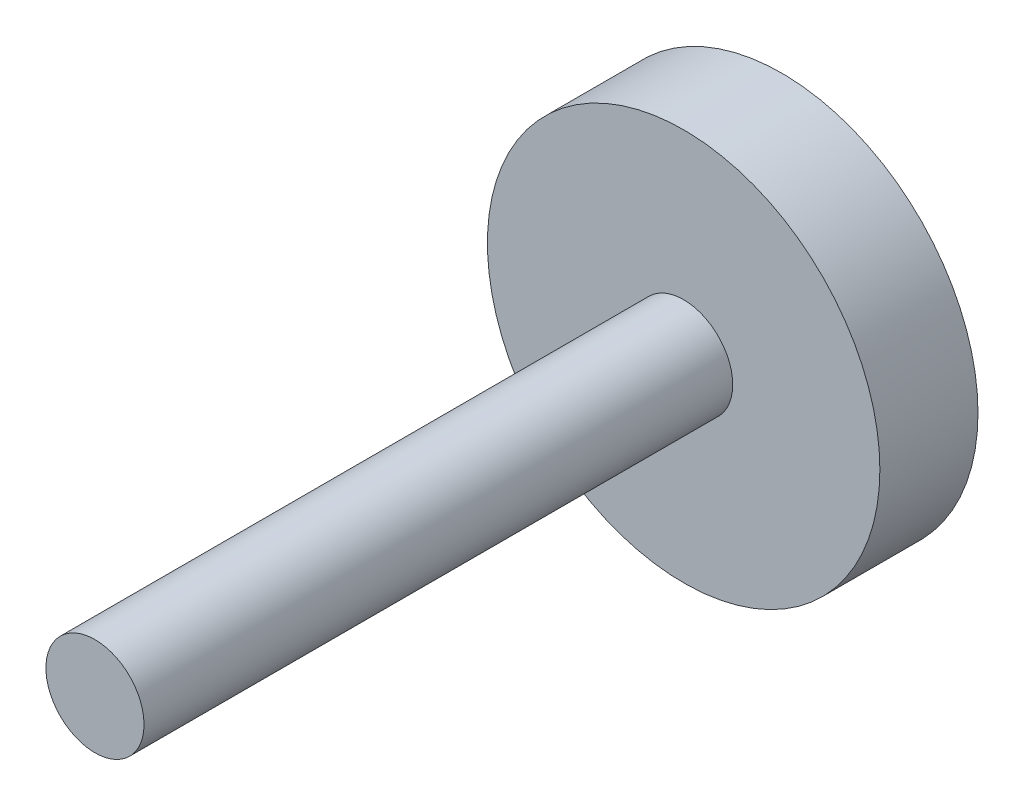
from build123d import *

# Parameters (mm, degrees)
SKETCH1_R           = 5
BOSS_EXTRUDE1_DEPTH = 1.25
SKETCH2_R           = 1.25
BOSS_EXTRUDE2_DEPTH = 15
BOSS_EXTRUDE3_DEPTH = 1


with BuildPart() as part:
    # Sketch1 → Boss-Extrude1 (new, symmetric)
    with BuildSketch(Plane.XY):
        Circle(SKETCH1_R)
    extrude(amount=BOSS_EXTRUDE1_DEPTH, both=True)

    # Sketch2 → Boss-Extrude2 (add)
    with BuildSketch(Plane.XY.offset(1.25)):
        Circle(SKETCH2_R)
    extrude(amount=BOSS_EXTRUDE2_DEPTH)

    # Sketch4 → Boss-Extrude3 (add)
    # profile 1 of 2: a face of its own
    with BuildSketch(Plane(origin=(0, 0, -1.25), x_dir=(-1, 0, 0), z_dir=(0, 0, -1))):
        Polygon((-1.553943212, 1.601672339), (-0.973370295, 1.601672339), (-0.973370295, -1.538327661), (-1.255165167, -1.538327661), (-1.255165167, 1.279621057), (-1.73824209, 1.279621057), align=None)
    # profile 2 of 2: a face of its own
    with BuildSketch(Plane(origin=(0, 0, -1.25), x_dir=(-1, 0, 0), z_dir=(0, 0, -1))):
        with BuildLine():
            Line((1.643296371, 1.68218516), (1.860303583, 1.511724423))
            Line((1.860303583, 1.511724423), (1.030644128, 0.243018493))
            add(Edge.make_bspline(
                [(1.030644128, 0.243018493), (1.085881462, 0.251822928), (1.193628128, 0.268996974), (1.302690105, 0.271830102), (1.355840442, 0.273210801)],
                knots=[0, 0, 0, 0, 1.025318673, 2, 2, 2, 2], degree=3))
            add(Edge.make_bspline(
                [(1.355840442, 0.273210801), (1.387754053, 0.272353032), (1.450575046, 0.27066454), (1.542807435, 0.257670457), (1.631435223, 0.23719307), (1.716091069, 0.207343104), (1.79707883, 0.16921242), (1.874863266, 0.123512976), (1.947982212, 0.067885023), (2.01737727, 0.005744463), (2.080381009, -0.063081632), (2.136161813, -0.13611026), (2.183016706, -0.213265336), (2.221032167, -0.294507781), (2.250552544, -0.379712363), (2.272072888, -0.468770065), (2.284794009, -0.561742299), (2.286521449, -0.624971291), (2.287398935, -0.65708968)],
                knots=[0, 0, 0, 0, 1.04369286, 2.054478336, 3.041073146, 4.015093852, 4.984733326, 5.965804835, 6.960378782, 7.985147595, 9.009457201, 10.008161701, 10.986880575, 11.956520048, 12.937015923, 13.931873656, 14.949455224, 16, 16, 16, 16], degree=3))
            add(Edge.make_bspline(
                [(2.287398935, -0.65708968), (2.286122207, -0.701031472), (2.283609908, -0.787498518), (2.258576216, -0.913436478), (2.219676421, -1.033413649), (2.164073724, -1.145514494), (2.095009529, -1.249585371), (2.010787917, -1.341798617), (1.914395759, -1.424039736), (1.805404746, -1.492811674), (1.68810963, -1.548975554), (1.564885266, -1.5893158), (1.436928341, -1.614151827), (1.350080778, -1.617265453), (1.306148935, -1.618840481)],
                knots=[0, 0, 0, 0, 1.031375318, 2.029502543, 3.004789286, 3.987476834, 4.960371455, 5.9300674, 6.912260825, 7.929083631, 8.949397511, 9.960523116, 10.96833055, 12, 12, 12, 12], degree=3))
            add(Edge.make_bspline(
                [(1.306148935, -1.618840481), (1.263896467, -1.617469462), (1.180201724, -1.614753714), (1.057084303, -1.590561416), (0.938784339, -1.5513499), (0.826130666, -1.497329091), (0.721774459, -1.429094304), (0.628412717, -1.346949859), (0.546510953, -1.252651654), (0.478350865, -1.146214313), (0.424290174, -1.031837609), (0.383748355, -0.912573988), (0.360067154, -0.788858005), (0.356757992, -0.704992069), (0.355091243, -0.662750738)],
                knots=[0, 0, 0, 0, 1.012016664, 2.004627821, 2.994792927, 3.992885782, 4.990978636, 5.973936114, 6.964471063, 7.975201453, 8.993600317, 9.990122807, 10.98767138, 12, 12, 12, 12], degree=3))
            add(Edge.make_bspline(
                [(0.355091243, -0.662750738), (0.356151168, -0.630413597), (0.358315332, -0.564387335), (0.37342626, -0.464388179), (0.397707247, -0.362068065), (0.424899868, -0.275265732), (0.453631415, -0.204156823), (0.477542551, -0.146826263), (0.507304364, -0.087829186), (0.539039341, -0.025142553), (0.575604074, 0.039618093), (0.615361543, 0.107535099), (0.659410944, 0.177528325), (0.690290747, 0.225026832), (0.70607682, 0.249308557)],
                knots=[0, 0, 0, 0, 1.173818275, 2.396712641, 3.66331629, 4.989737886, 5.693666774, 6.447286557, 7.243889047, 8.091586357, 8.998013824, 9.943181721, 10.948533338, 12, 12, 12, 12], degree=3))
            Line((0.70607682, 0.249308557), (1.643296371, 1.68218516))
        make_face()
        with BuildLine():
            add(Edge.make_bspline(
                [(1.296713839, -0.048840481), (1.272793997, -0.049538498), (1.226071596, -0.050901926), (1.157523229, -0.058819438), (1.092647912, -0.073729114), (1.030586141, -0.092718337), (0.972498202, -0.11882794), (0.917961928, -0.150543554), (0.866766425, -0.187883696), (0.819447924, -0.230319371), (0.776546855, -0.276780635), (0.739601497, -0.32654472), (0.70773283, -0.37841232), (0.681821712, -0.432816805), (0.661644901, -0.489737379), (0.647049956, -0.548912248), (0.638927448, -0.610738226), (0.637576143, -0.652663957), (0.636886115, -0.674072853)],
                knots=[0, 0, 0, 0, 1.129588631, 2.206414736, 3.251139165, 4.268635594, 5.265702196, 6.250456724, 7.242448911, 8.251968645, 9.246821453, 10.222880186, 11.173611482, 12.116736599, 13.062300278, 14.020270554, 14.989073742, 16, 16, 16, 16], degree=3))
            add(Edge.make_bspline(
                [(0.636886115, -0.674072853), (0.637448051, -0.695290264), (0.638549923, -0.736894447), (0.648555147, -0.798204454), (0.66383805, -0.857204972), (0.686572005, -0.913591834), (0.713689841, -0.968224531), (0.749490618, -1.019124187), (0.789159392, -1.069382193), (0.83657692, -1.115137799), (0.88746588, -1.15771317), (0.941833816, -1.194926883), (0.998497323, -1.22676305), (1.058221399, -1.251713578), (1.120158692, -1.272190224), (1.184825246, -1.286599665), (1.252266037, -1.294746194), (1.29795029, -1.296099259), (1.321245089, -1.296789199)],
                knots=[0, 0, 0, 0, 0.989467248, 1.94019797, 2.891935182, 3.827694429, 4.772920941, 5.730924762, 6.725747692, 7.756678648, 8.79901574, 9.819492441, 10.826891316, 11.826466727, 12.835195252, 13.867842842, 14.912794438, 16, 16, 16, 16], degree=3))
            add(Edge.make_bspline(
                [(1.321245089, -1.296789199), (1.344539851, -1.296099205), (1.390224029, -1.294746034), (1.457665362, -1.286600274), (1.522329911, -1.27218799), (1.584274493, -1.251721676), (1.643971662, -1.226733009), (1.700585612, -1.195124944), (1.754439388, -1.157484313), (1.805361754, -1.115210557), (1.852581916, -1.06912177), (1.893202103, -1.019572819), (1.92790649, -0.967813153), (1.956107446, -0.913807046), (1.978591005, -0.857170877), (1.993951407, -0.798213588), (2.003935969, -0.736892056), (2.00504068, -0.695289456), (2.005604064, -0.674072853)],
                knots=[0, 0, 0, 0, 1.087397944, 2.132534446, 3.165364764, 4.174271784, 5.174024072, 6.181601208, 7.194203697, 8.236725232, 9.267838612, 10.269026844, 11.221737037, 12.171628256, 13.107553087, 14.05945871, 15.010357665, 16, 16, 16, 16], degree=3))
            add(Edge.make_bspline(
                [(2.005604064, -0.674072853), (2.005110372, -0.652636027), (2.004141416, -0.61056251), (1.993181965, -0.548939904), (1.977982236, -0.489436719), (1.955030603, -0.432426925), (1.925212674, -0.378135493), (1.888893274, -0.326288171), (1.846877768, -0.276487459), (1.798344547, -0.230228254), (1.745511594, -0.18793059), (1.689336469, -0.150591902), (1.630566459, -0.11907978), (1.56926115, -0.092787123), (1.504718107, -0.073813023), (1.437979346, -0.058872685), (1.368191282, -0.050922189), (1.320843125, -0.049543222), (1.296713839, -0.048840481)],
                knots=[0, 0, 0, 0, 0.978206639, 1.919901502, 2.851605144, 3.780102724, 4.718870031, 5.675451981, 6.667674623, 7.690630536, 8.733308323, 9.756129687, 10.767539656, 11.776269907, 12.797430371, 13.836405707, 14.897401972, 16, 16, 16, 16], degree=3))
        make_face(mode=Mode.SUBTRACT)
    extrude(amount=BOSS_EXTRUDE3_DEPTH)


solid = part.part
